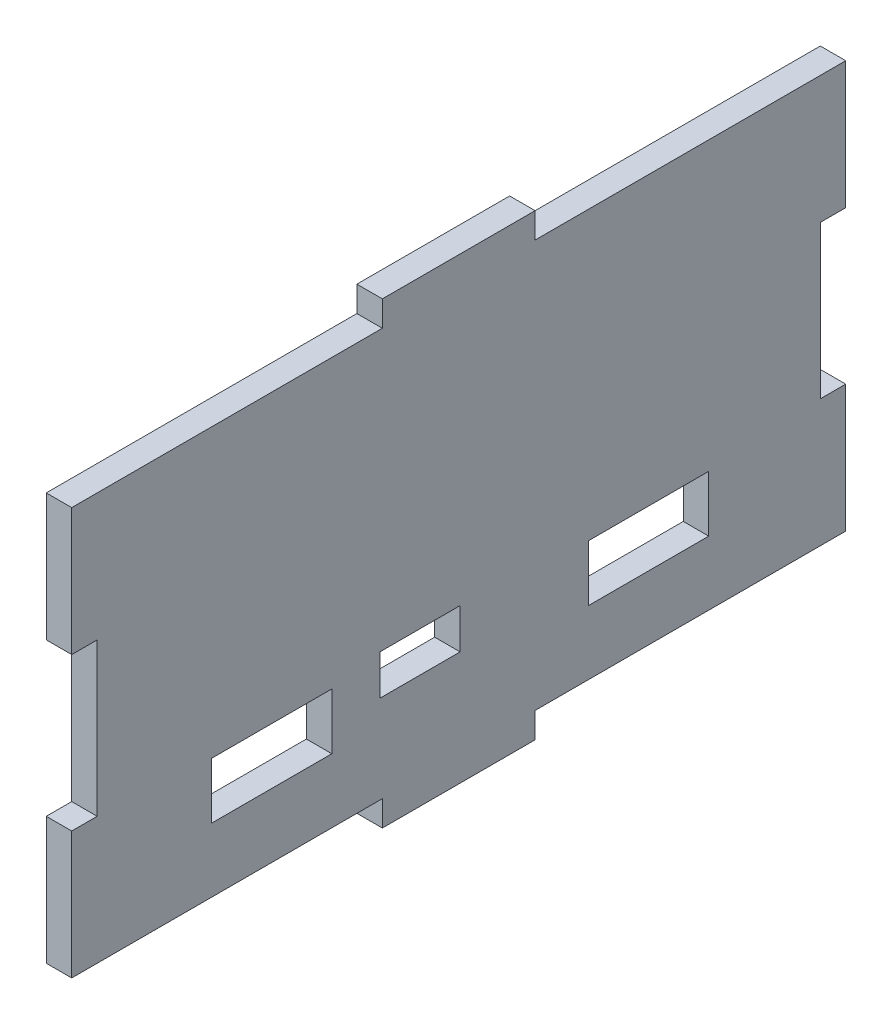
from build123d import *

# Parameters (mm, degrees)
SKETCH1_W           = 15
SKETCH1_H           = 7
SKETCH1_W_2         = 10
SKETCH1_H_2         = 5
BOSS_EXTRUDE1_DEPTH = 3.175


with BuildPart() as part:
    # Sketch1 → Boss-Extrude1 (new body)
    with BuildSketch(Plane(origin=(0, 0, 0), x_dir=(0, 0, -1), z_dir=(1, 0, 0))):
        Polygon((0, 0), (38.735, 0), (38.735, -3.175), (57.785, -3.175), (57.785, 0), (96.52, 0), (96.52, 15.875), (93.345, 15.875), (93.345, 34.925), (96.52, 34.925), (96.52, 50.8), (57.785, 50.8), (57.785, 53.975), (38.735, 53.975), (38.735, 50.8), (0, 50.8), (0, 34.925), (3.175, 34.925), (3.175, 15.875), (0, 15.875), align=None)
        with Locations((24.935438503, 11.5)):
            Rectangle(SKETCH1_W, SKETCH1_H, mode=Mode.SUBTRACT)
        with Locations((43.435438503, 13.5)):
            Rectangle(SKETCH1_W_2, SKETCH1_H_2, mode=Mode.SUBTRACT)
        with Locations((71.935438503, 11.5)):
            Rectangle(SKETCH1_W, SKETCH1_H, mode=Mode.SUBTRACT)
    extrude(amount=BOSS_EXTRUDE1_DEPTH)


solid = part.part
